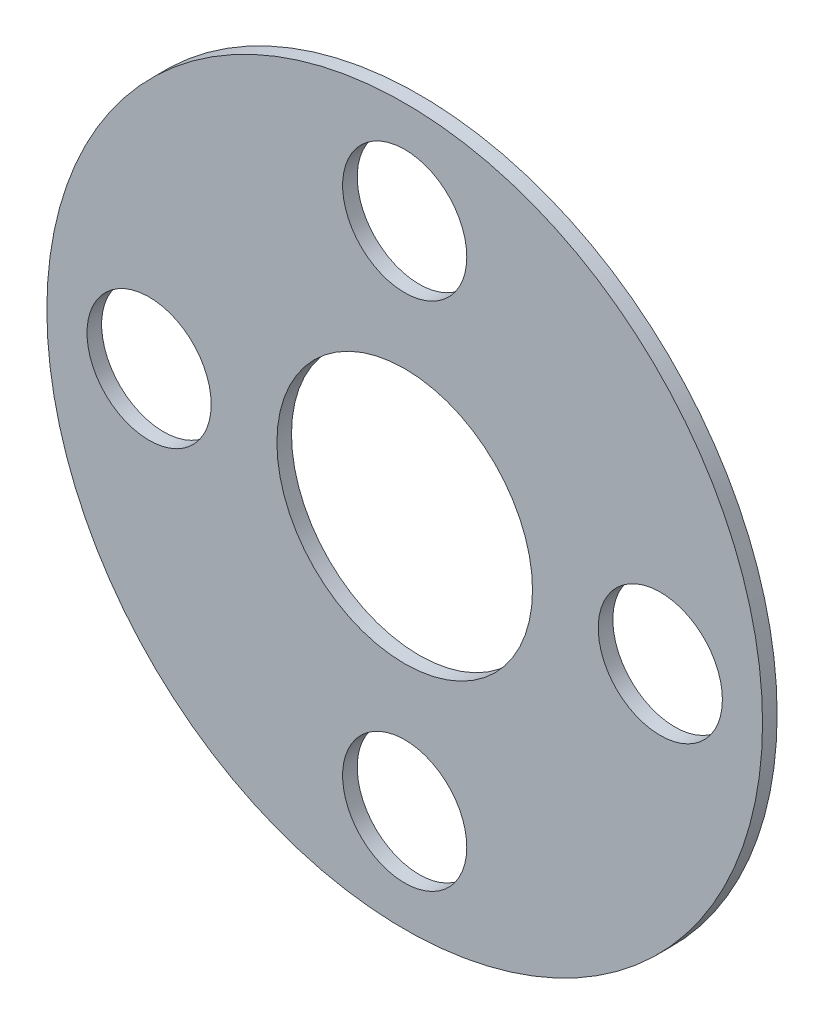
from build123d import *

# Parameters (mm, degrees)
S_CYL1_R     = 9.8
BOSS_1_DEPTH = 0.4
S_HOLE2_R    = 3.5
HOLE_2_DEPTH = 0.6
S_HOLE3_R    = 1.7
HOLE_3_DEPTH = 0.6
S_HOLE4_R    = 1.7
HOLE_4_DEPTH = 0.6
S_HOLE5_R    = 1.7
HOLE_5_DEPTH = 0.6
S_HOLE6_R    = 1.7
HOLE_6_DEPTH = 0.6


with BuildPart() as part:
    # S_cyl1 → Boss_1 (new body)
    with BuildSketch(Plane.XY):
        Circle(S_CYL1_R)
    extrude(amount=BOSS_1_DEPTH)

    # S_hole2 → Hole_2 (cut)
    with BuildSketch(Plane.XY.offset(-0.1)):
        Circle(S_HOLE2_R)
    extrude(amount=HOLE_2_DEPTH, mode=Mode.SUBTRACT)

    # S_hole3 → Hole_3 (cut)
    with BuildSketch(Plane.XY.offset(-0.1)):
        with Locations((7, 0)):
            Circle(S_HOLE3_R)
    extrude(amount=HOLE_3_DEPTH, mode=Mode.SUBTRACT)

    # S_hole4 → Hole_4 (cut)
    with BuildSketch(Plane.XY.offset(-0.1)):
        with Locations((0, 7)):
            Circle(S_HOLE4_R)
    extrude(amount=HOLE_4_DEPTH, mode=Mode.SUBTRACT)

    # S_hole5 → Hole_5 (cut)
    with BuildSketch(Plane.XY.offset(-0.1)):
        with Locations((-7, 0)):
            Circle(S_HOLE5_R)
    extrude(amount=HOLE_5_DEPTH, mode=Mode.SUBTRACT)

    # S_hole6 → Hole_6 (cut)
    with BuildSketch(Plane.XY.offset(-0.1)):
        with Locations((0, -7)):
            Circle(S_HOLE6_R)
    extrude(amount=HOLE_6_DEPTH, mode=Mode.SUBTRACT)


solid = part.part
